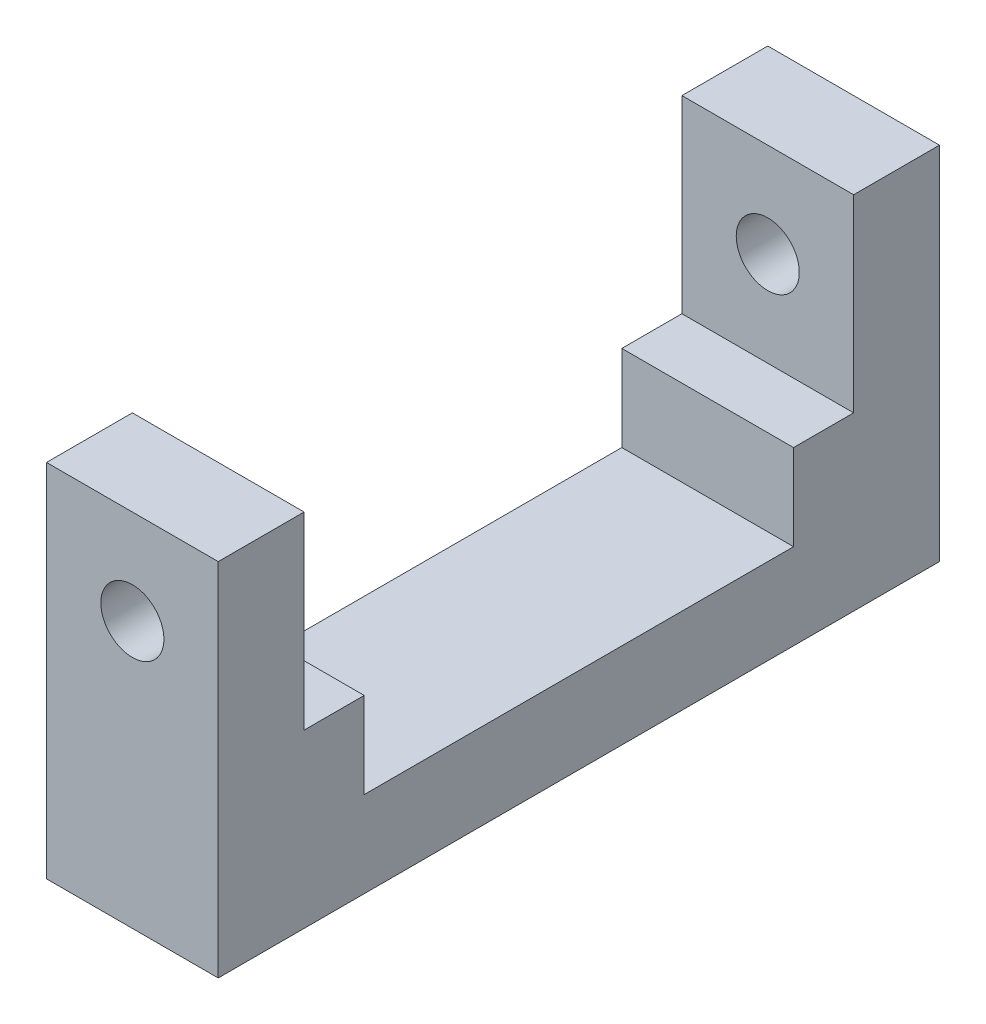
from build123d import *

# Parameters (mm, degrees)
SKETCH1_W               = 3.5
SKETCH1_H               = 5
BOSS_EXTRUDE1_DEPTH     = 10
CUT_EXTRUDE1_DEPTH      = 53
CUT_EXTRUDE1_DEPTH_BACK = 10
SKETCH2_R               = 1.836585915


with BuildPart() as part:
    # Sketch1 → Boss-Extrude1 (new body)
    with BuildSketch(Plane(origin=(0, 0, 0), x_dir=(0, 0, -1), z_dir=(1, 0, 0))):
        Polygon((-21, 10.5), (-21, -10.5), (21, -10.5), (21, 10.5), (16, 10.5), (16, -0.5), (16, -5.5), (12.5, -5.5), (-12.5, -5.5), (-16, -5.5), (-16, -0.5), (-16, 10.5), align=None)
        with Locations((-14.25, -3)):
            Rectangle(SKETCH1_W, SKETCH1_H)
        with Locations((14.25, -3)):
            Rectangle(SKETCH1_W, SKETCH1_H)
    extrude(amount=BOSS_EXTRUDE1_DEPTH)

    # Sketch2 → Cut-Extrude1 (cut, two sides: drawn at the far end of the back side and taken through both)
    with BuildSketch(Plane.XY.offset(-16).offset(-CUT_EXTRUDE1_DEPTH_BACK)):
        with Locations(Location((5, 5, 0), (0, 0, 180))):
            Circle(SKETCH2_R)
    extrude(amount=CUT_EXTRUDE1_DEPTH + CUT_EXTRUDE1_DEPTH_BACK, mode=Mode.SUBTRACT)


solid = part.part
